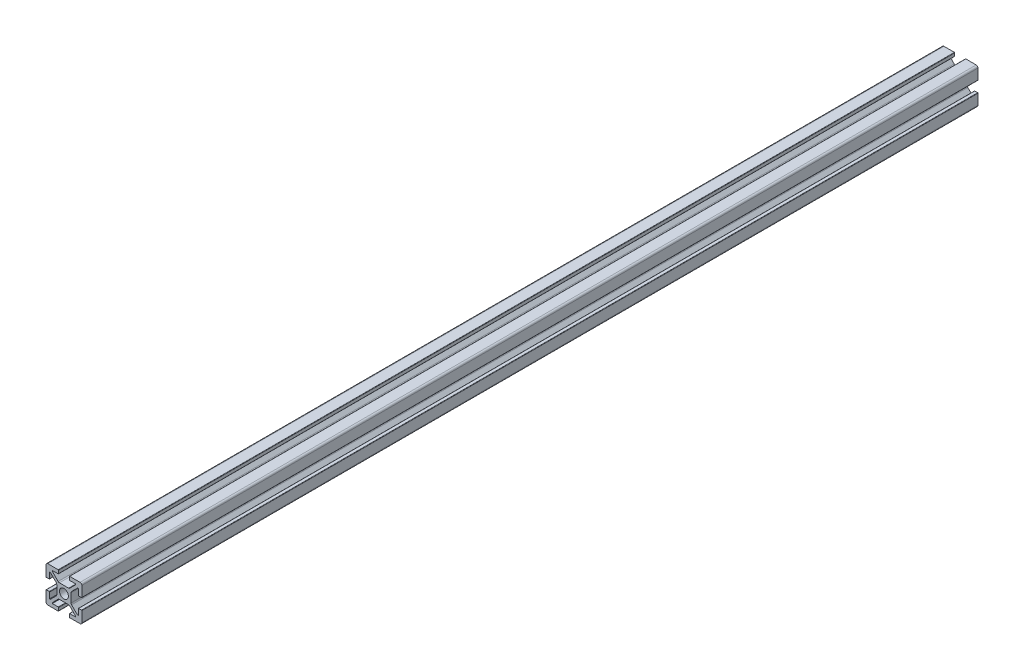
from build123d import *

# Parameters (mm, degrees)
SKETCH1_R           = 2.5
BOSS_EXTRUDE1_DEPTH = 500


with BuildPart() as part:
    # Sketch1 → Boss-Extrude1 (new body)
    with BuildSketch(Plane.XY):
        with BuildLine():
            Line((0.2, 13), (1.8, 13))
            ThreePointArc((1.8, 13), (1.941421356, 13.058578644), (2, 13.2))
            Line((2, 13.2), (2, 16.5))
            Line((2, 16.5), (2.439339828, 16.5))
            Line((2.439339828, 16.5), (5.707106781, 13.232233047))
            ThreePointArc((5.707106781, 13.232233047), (5.923879533, 12.907809698), (6, 12.525126266))
            Line((6, 12.525126266), (6, 7.474873734))
            ThreePointArc((6, 7.474873734), (5.923879533, 7.092190302), (5.707106781, 6.767766953))
            Line((5.707106781, 6.767766953), (2.439339828, 3.5))
            Line((2.439339828, 3.5), (2, 3.5))
            Line((2, 3.5), (2, 6.8))
            ThreePointArc((2, 6.8), (1.941421356, 6.941421356), (1.8, 7))
            Line((1.8, 7), (0.2, 7))
            ThreePointArc((0.2, 7), (0.058578644, 6.941421356), (0, 6.8))
            Line((0, 6.8), (0, 1))
            ThreePointArc((0, 1), (0.292893219, 0.292893219), (1, 0))
            Line((1, 0), (6.8, 0))
            ThreePointArc((6.8, 0), (6.941421356, 0.058578644), (7, 0.2))
            Line((7, 0.2), (7, 1.8))
            ThreePointArc((7, 1.8), (6.941421356, 1.941421356), (6.8, 2))
            Line((6.8, 2), (3.5, 2))
            Line((3.5, 2), (3.5, 2.439339828))
            Line((3.5, 2.439339828), (6.767766953, 5.707106781))
            ThreePointArc((6.767766953, 5.707106781), (7.092190302, 5.923879533), (7.474873734, 6))
            Line((7.474873734, 6), (10, 6))
            Line((10, 6), (12.525126266, 6))
            ThreePointArc((12.525126266, 6), (12.907809698, 5.923879533), (13.232233047, 5.707106781))
            Line((13.232233047, 5.707106781), (16.5, 2.439339828))
            Line((16.5, 2.439339828), (16.5, 2))
            Line((16.5, 2), (13.2, 2))
            ThreePointArc((13.2, 2), (13.058578644, 1.941421356), (13, 1.8))
            Line((13, 1.8), (13, 0.2))
            ThreePointArc((13, 0.2), (13.058578644, 0.058578644), (13.2, 0))
            Line((13.2, 0), (19, 0))
            ThreePointArc((19, 0), (19.707106781, 0.292893219), (20, 1))
            Line((20, 1), (20, 6.8))
            ThreePointArc((20, 6.8), (19.941421356, 6.941421356), (19.8, 7))
            Line((19.8, 7), (18.2, 7))
            ThreePointArc((18.2, 7), (18.058578644, 6.941421356), (18, 6.8))
            Line((18, 6.8), (18, 3.5))
            Line((18, 3.5), (17.560660172, 3.5))
            Line((17.560660172, 3.5), (14.292893219, 6.767766953))
            ThreePointArc((14.292893219, 6.767766953), (14.076120467, 7.092190302), (14, 7.474873734))
            Line((14, 7.474873734), (14, 12.525126266))
            ThreePointArc((14, 12.525126266), (14.076120467, 12.907809698), (14.292893219, 13.232233047))
            Line((14.292893219, 13.232233047), (17.560660172, 16.5))
            Line((17.560660172, 16.5), (18, 16.5))
            Line((18, 16.5), (18, 13.2))
            ThreePointArc((18, 13.2), (18.058578644, 13.058578644), (18.2, 13))
            Line((18.2, 13), (19.8, 13))
            ThreePointArc((19.8, 13), (19.941421356, 13.058578644), (20, 13.2))
            Line((20, 13.2), (20, 19))
            ThreePointArc((20, 19), (19.707106781, 19.707106781), (19, 20))
            Line((19, 20), (13.2, 20))
            ThreePointArc((13.2, 20), (13.058578644, 19.941421356), (13, 19.8))
            Line((13, 19.8), (13, 18.2))
            ThreePointArc((13, 18.2), (13.058578644, 18.058578644), (13.2, 18))
            Line((13.2, 18), (16.5, 18))
            Line((16.5, 18), (16.5, 17.560660172))
            Line((16.5, 17.560660172), (13.232233047, 14.292893219))
            ThreePointArc((13.232233047, 14.292893219), (12.907809698, 14.076120467), (12.525126266, 14))
            Line((12.525126266, 14), (10, 14))
            Line((10, 14), (7.474873734, 14))
            ThreePointArc((7.474873734, 14), (7.092190302, 14.076120467), (6.767766953, 14.292893219))
            Line((6.767766953, 14.292893219), (3.5, 17.560660172))
            Line((3.5, 17.560660172), (3.5, 18))
            Line((3.5, 18), (6.8, 18))
            ThreePointArc((6.8, 18), (6.941421356, 18.058578644), (7, 18.2))
            Line((7, 18.2), (7, 19.8))
            ThreePointArc((7, 19.8), (6.941421356, 19.941421356), (6.8, 20))
            Line((6.8, 20), (1, 20))
            ThreePointArc((1, 20), (0.292893219, 19.707106781), (0, 19))
            Line((0, 19), (0, 13.2))
            ThreePointArc((0, 13.2), (0.058578644, 13.058578644), (0.2, 13))
        make_face()
        with Locations((10, 10)):
            Circle(SKETCH1_R, mode=Mode.SUBTRACT)
    extrude(amount=BOSS_EXTRUDE1_DEPTH)


solid = part.part
